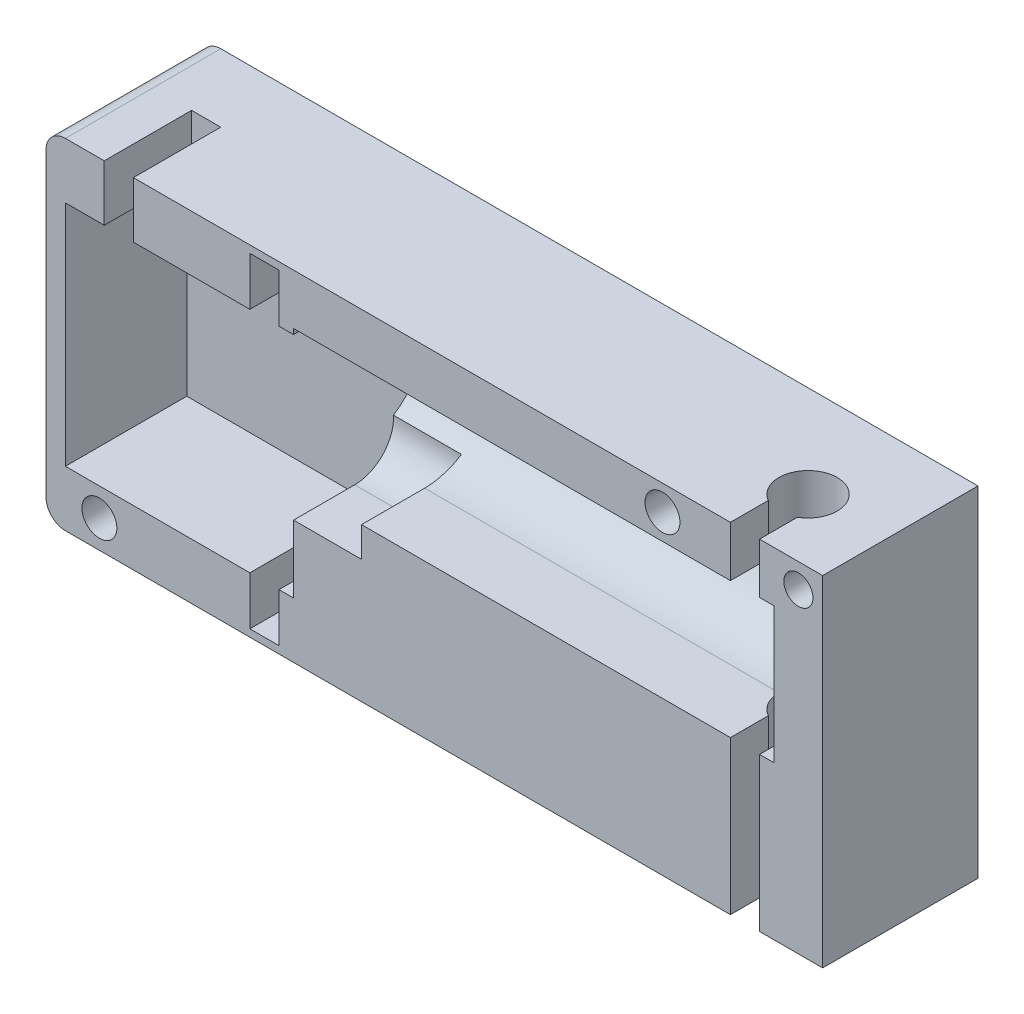
from build123d import *

# Parameters (mm, degrees)
SKETCH1_W           = 75
SKETCH1_H           = 35
BOSS_EXTRUDE5_DEPTH = 16
CUT_EXTRUDE1_DEPTH  = 12.5
CUT_EXTRUDE2_REACH  = 56.886
CUT_EXTRUDE3_DEPTH  = 7
SKETCH6_W           = 16
SKETCH6_H           = 35
BOSS_EXTRUDE6_DEPTH = 5
CUT_EXTRUDE4_DEPTH  = 58.334544561
SKETCH8_R           = 1.5
CUT_EXTRUDE5_DEPTH  = 13
SKETCH10_W          = 3
SKETCH10_H          = 5.75
CUT_EXTRUDE6_DEPTH  = 9
FILLET1_R           = 2
SKETCH11_R          = 1.8
CUT_EXTRUDE7_DEPTH  = 12


with BuildPart() as part:
    # Sketch1 → Boss-Extrude5 (new body)
    with BuildSketch(Plane.XY):
        Rectangle(SKETCH1_W, SKETCH1_H)
    extrude(amount=BOSS_EXTRUDE5_DEPTH)

    # Sketch2 → Cut-Extrude1 (cut)
    with BuildSketch(Plane.XY.offset(16)):
        Polygon((-35.5, 11.75), (-16.5, 11.75), (-16.5, 16.75), (-13.5, 16.75), (-13.5, 11.75), (-12, 11.75), (-12, -11.75), (-13.5, -11.75), (-13.5, -16.75), (-16.5, -16.75), (-16.5, -11.75), (-35.5, -11.75), align=None)
    extrude(amount=-CUT_EXTRUDE1_DEPTH, mode=Mode.SUBTRACT)

    # Sketch3 → Cut-Extrude2 (cut, up to next)
    with BuildSketch(Plane.ZY.offset(12), mode=Mode.PRIVATE) as cut_extrude2_sk1:
        with BuildLine():
            Line((9.5, 12.296655642), (16, 12.296655642))
            Line((16, 12.296655642), (16, -1.703344358))
            Line((16, -1.703344358), (9.5, -1.703344358))
            ThreePointArc((9.5, -1.703344358), (2.5, 5.296655642), (9.5, 12.296655642))
        make_face()
    cut_extrude2_tool1 = extrude(cut_extrude2_sk1.sketch, amount=-CUT_EXTRUDE2_REACH, mode=Mode.PRIVATE) & part.part
    add(cut_extrude2_tool1.solids().sort_by_distance((-12, 5.296656, 9.899379))[0], mode=Mode.SUBTRACT)

    # Sketch5 → Cut-Extrude3 (cut)
    with BuildSketch(Plane.ZY.offset(12)):
        with BuildLine():
            Line((9.702025117, -4.799998018), (16, -4.799998018))
            Line((16, -4.799998018), (16, 3.200001982))
            Line((16, 3.200001982), (9.702025117, 3.200001982))
            ThreePointArc((9.702025117, 3.200001982), (5.702025117, -0.799998018), (9.702025117, -4.799998018))
        make_face()
    extrude(amount=-CUT_EXTRUDE3_DEPTH, mode=Mode.SUBTRACT)

    # Sketch6 → Boss-Extrude6 (add)
    with BuildSketch(Plane(origin=(37.5, 0, 0), x_dir=(0, 0, -1), z_dir=(1, 0, 0))):
        with Locations((-8, 0)):
            Rectangle(SKETCH6_W, SKETCH6_H)
    extrude(amount=BOSS_EXTRUDE6_DEPTH)

    # Sketch7 → Cut-Extrude4 (cut, through all)
    with BuildSketch(Plane.XZ.offset(17.5)):
        with BuildLine():
            Line((32.99668066, 12.098076211), (32.99668066, 16))
            Line((32.99668066, 16), (35.99668066, 16))
            Line((35.99668066, 16), (35.99668066, 12.098076211))
            ThreePointArc((35.99668066, 12.098076211), (34.49668066, 6.5), (32.99668066, 12.098076211))
        make_face()
    extrude(amount=-CUT_EXTRUDE4_DEPTH, mode=Mode.SUBTRACT)

    # Sketch8 → Cut-Extrude5 (cut)
    with BuildSketch(Plane.XY.offset(16)):
        with Locations((40, 15)):
            Circle(SKETCH8_R)
    extrude(amount=-CUT_EXTRUDE5_DEPTH, mode=Mode.SUBTRACT)

    # Sketch10 → Cut-Extrude6 (cut)
    with BuildSketch(Plane.XY.offset(16)):
        with Locations((-30, 14.625)):
            Rectangle(SKETCH10_W, SKETCH10_H)
    extrude(amount=-CUT_EXTRUDE6_DEPTH, mode=Mode.SUBTRACT)

    # Fillet1
    fillet1_edges = [part.edges().sort_by_distance(p)[0] for p in [
        (-37.5, -17.5, 8),
        (-37.5, 17.5, 8),
    ]]
    fillet(fillet1_edges, radius=FILLET1_R)

    # Sketch11 → Cut-Extrude7 (cut)
    with BuildSketch(Plane.XY.offset(16)):
        with Locations((-32, -14.625)):
            Circle(SKETCH11_R)
        with Locations((26, 14.898327821)):
            Circle(SKETCH11_R)
    extrude(amount=-CUT_EXTRUDE7_DEPTH, mode=Mode.SUBTRACT)


solid = part.part
